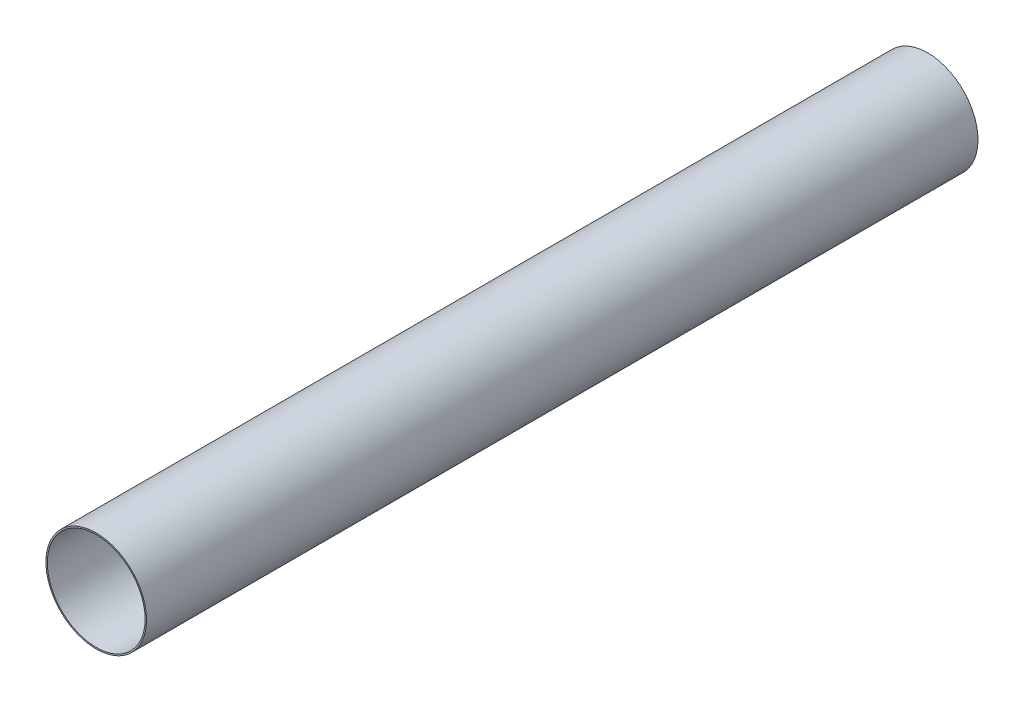
from build123d import *

# Parameters (mm, degrees)
SKETCH1_R           = 78.359
SKETCH1_R_2         = 76.2
BOSS_EXTRUDE1_DEPTH = 1295.4


with BuildPart() as part:
    # Sketch1 → Boss-Extrude1 (new body)
    with BuildSketch(Plane.XY):
        Circle(SKETCH1_R)
        Circle(SKETCH1_R_2, mode=Mode.SUBTRACT)
    extrude(amount=BOSS_EXTRUDE1_DEPTH)


solid = part.part
